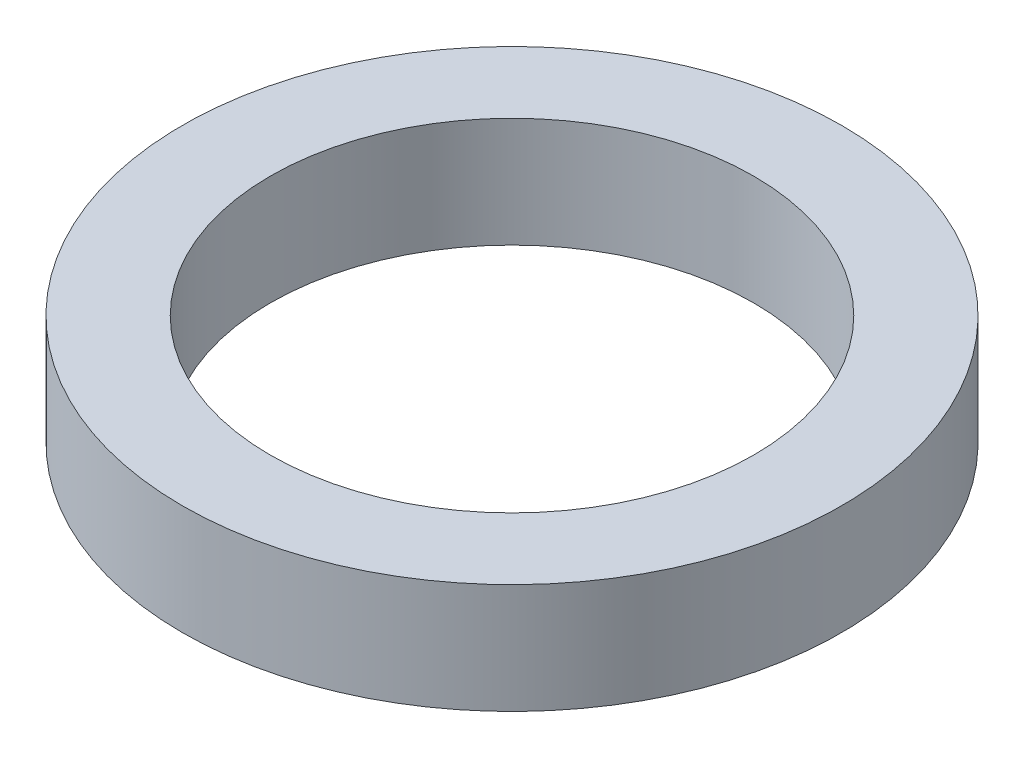
from build123d import *

# Parameters (mm, degrees)
SKETCH_1_R      = 15
SKETCH_1_R_2    = 11
EXTRUDE_1_DEPTH = 5


with BuildPart() as part:
    # 草图1 → 凸台-拉伸1 (new body)
    with BuildSketch(Plane(origin=(0, 0, 0), x_dir=(1, 0, 0), z_dir=(0, 1, 0))):
        with Locations(Location((0, 0, 0), (0, 0, 270))):
            Circle(SKETCH_1_R)
        with Locations(Location((0, 0, 0), (0, 0, 270))):
            Circle(SKETCH_1_R_2, mode=Mode.SUBTRACT)
    extrude(amount=EXTRUDE_1_DEPTH)


solid = part.part
